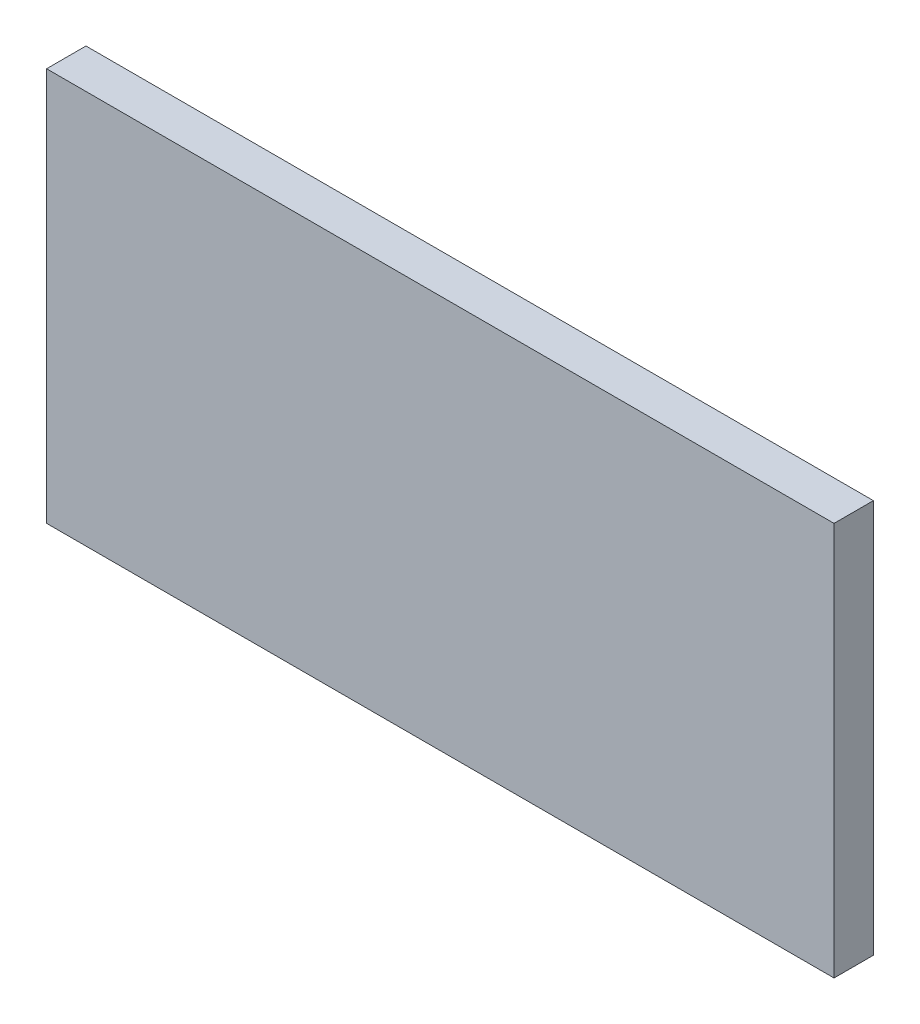
from build123d import *

# Parameters (mm, degrees)
SKETCH1_W           = 100
SKETCH1_H           = 50
BOSS_EXTRUDE1_DEPTH = 5


with BuildPart() as part:
    # Sketch1 → Boss-Extrude1 (new body)
    with BuildSketch(Plane.XY):
        Rectangle(SKETCH1_W, SKETCH1_H)
    extrude(amount=BOSS_EXTRUDE1_DEPTH)


solid = part.part
